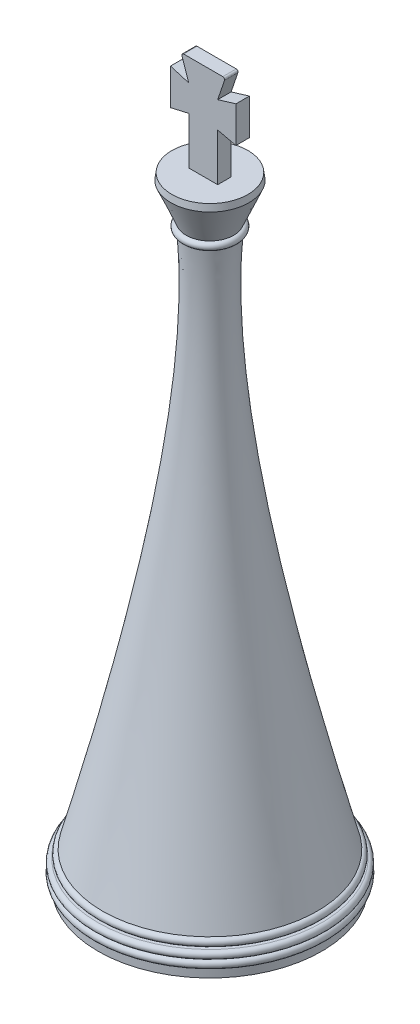
from build123d import *

# Parameters (mm, degrees)
SKETCH2_R           = 12.5
BOSS_EXTRUDE1_DEPTH = 1
SKETCH18_R          = 2.660336072
BOSS_EXTRUDE2_DEPTH = 4
BOSS_EXTRUDE2_DRAFT = -23
SKETCH22_R          = 4.358235337
BOSS_EXTRUDE3_DEPTH = 0.75
BOSS_EXTRUDE3_TAPER = 8
BOSS_EXTRUDE6_DEPTH = 0.75
CIRPATTERN3_COUNT   = 2
FILLET4_R           = 0.2


with BuildPart() as part:
    # Sketch2 → Boss-Extrude1 (new body)
    with BuildSketch(Plane(origin=(0, 0, 0), x_dir=(1, 0, 0), z_dir=(0, 1, 0))):
        with Locations(Location((0, 0, 0), (0, 0, 270))):
            Circle(SKETCH2_R)
    extrude(amount=BOSS_EXTRUDE1_DEPTH)

    # Sketch9 → Revolve1 (revolve)
    with BuildSketch(Plane.XY, mode=Mode.PRIVATE) as revolve1_sk:
        with BuildLine():
            Line((0, 1), (12.5, 1))
            ThreePointArc((12.5, 1), (12.952293858, 1.452293858), (12.5, 1.904587717))
            Line((12.5, 1.904587717), (0, 1.904587717))
            Line((0, 1.904587717), (0, 1))
        make_face()
    revolve(revolve1_sk.sketch.rotate(Axis((0, 1.904587717, 0), (0, -1, 0)), 90), axis=Axis((0, 1.904587717, 0), (0, -1, 0)))

    # Sketch10 → Revolve2 (revolve)
    with BuildSketch(Plane.XY, mode=Mode.PRIVATE) as revolve2_sk:
        with BuildLine():
            Line((0, 1.904587717), (12.5, 1.904587717))
            ThreePointArc((12.5, 1.904587717), (12.93109981, 2.335687527), (12.5, 2.766787337))
            Line((12.5, 2.766787337), (0, 2.766787337))
            Line((0, 2.766787337), (0, 1.904587717))
        make_face()
    revolve(revolve2_sk.sketch.rotate(Axis((0, 2.766787337, 0), (0, -1, 0)), 90), axis=Axis((0, 2.766787337, 0), (0, -1, 0)))

    # Sketch12 → Revolve3 (revolve)
    with BuildSketch(Plane.XY, mode=Mode.PRIVATE) as revolve3_sk:
        with BuildLine():
            Line((0, 2.766787337), (12, 2.766787337))
            ThreePointArc((12, 2.766787337), (12.433628018, 3.200415354), (12, 3.634043372))
            Line((12, 3.634043372), (0, 3.634043372))
            Line((0, 3.634043372), (0, 2.766787337))
        make_face()
    revolve(revolve3_sk.sketch.rotate(Axis((0, 3.634043372, 0), (0, -1, 0)), 90), axis=Axis((0, 3.634043372, 0), (0, -1, 0)))

    # Sketch13 → Revolve4 (revolve)
    with BuildSketch(Plane.XY, mode=Mode.PRIVATE) as revolve4_sk:
        with BuildLine():
            Line((2.660336072, 63.504160051), (0, 63.504160051))
            Line((0, 63.504160051), (0, 3.634043372))
            Line((0, 3.634043372), (12, 3.634043372))
            add(Edge.make_bspline(
                [(12, 3.634043372), (0.989364931, 44.914606105), (2.660336072, 63.504160051)],
                knots=[0, 0, 0, 1, 1, 1], degree=2))
        make_face()
    revolve(revolve4_sk.sketch.rotate(Axis((0, 63.504160051, 0), (0, -1, 0)), 90), axis=Axis((0, 63.504160051, 0), (0, -1, 0)))

    # Sketch14 → Revolve5 (revolve)
    with BuildSketch(Plane.XY, mode=Mode.PRIVATE) as revolve5_sk:
        with BuildLine():
            Line((0, 63.504160051), (2.660336072, 63.504160051))
            ThreePointArc((2.660336072, 63.504160051), (3.082579386, 63.926403365), (2.660336072, 64.34864668))
            Line((2.660336072, 64.34864668), (0, 64.34864668))
            Line((0, 64.34864668), (0, 63.504160051))
        make_face()
    revolve(revolve5_sk.sketch.rotate(Axis((0, 64.34864668, 0), (0, -1, 0)), 90), axis=Axis((0, 64.34864668, 0), (0, -1, 0)))


with BuildPart() as boss_extrude2_tool:
    # Sketch18 → Boss-Extrude2 (with draft: the straight prism first)
    with BuildSketch(Plane(origin=(0, 64.34864668, 0), x_dir=(1, 0, 0), z_dir=(0, 1, 0))):
        Circle(SKETCH18_R)
    extrude(amount=BOSS_EXTRUDE2_DEPTH)
    # Boss-Extrude2: the draft: its side faces are tilted about the plane it starts from
    boss_extrude2_sides = [boss_extrude2_tool.faces().sort_by_distance(p)[0] for p in [
        (-2.660336072, 66.34864668, 0),
    ]]
    draft(boss_extrude2_sides, Plane(origin=(0, 64.34864668, 0), x_dir=(1, 0, 0), z_dir=(0, 1, 0)), BOSS_EXTRUDE2_DRAFT)


with BuildPart() as part_1:
    add(part.part)

    # Boss-Extrude2: add boss_extrude2_tool
    add(boss_extrude2_tool.part)

    # Sketch22 → Boss-Extrude3 (add)
    with BuildSketch(Plane(origin=(0, 68.34864668, 0), x_dir=(1, 0, 0), z_dir=(0, 1, 0))):
        Circle(SKETCH22_R)
    extrude(amount=BOSS_EXTRUDE3_DEPTH, taper=BOSS_EXTRUDE3_TAPER)

    # Sketch26 → Boss-Extrude6 (add, symmetric)
    with BuildSketch(Plane.XY):
        Polygon((0, 69.09864668), (1.615691626, 69.09864668), (1.615691626, 74.385715226), (3.654998177, 73.911457889), (3.654998177, 77.942645258), (1.615691626, 77.326110719), (2.469354833, 79.839674608), (0, 79.839674608), align=None)
    boss_extrude6 = extrude(amount=BOSS_EXTRUDE6_DEPTH, both=True)

    # CirPattern3: Boss-Extrude6 ×2 about axis
    cirpattern3_axis = Axis((0, 0.5, 0), (0, 1, 0))
    for i in range(1, CIRPATTERN3_COUNT):
        add(boss_extrude6.rotate(cirpattern3_axis, i * 360 / CIRPATTERN3_COUNT))

    # Fillet4
    fillet4_edges = [part_1.edges().sort_by_distance(p)[0] for p in [
        (2.469354833, 79.839674608, 0),
        (-2.469354833, 79.839674608, 0),
    ]]
    fillet(fillet4_edges, radius=FILLET4_R)


solid = part_1.part
